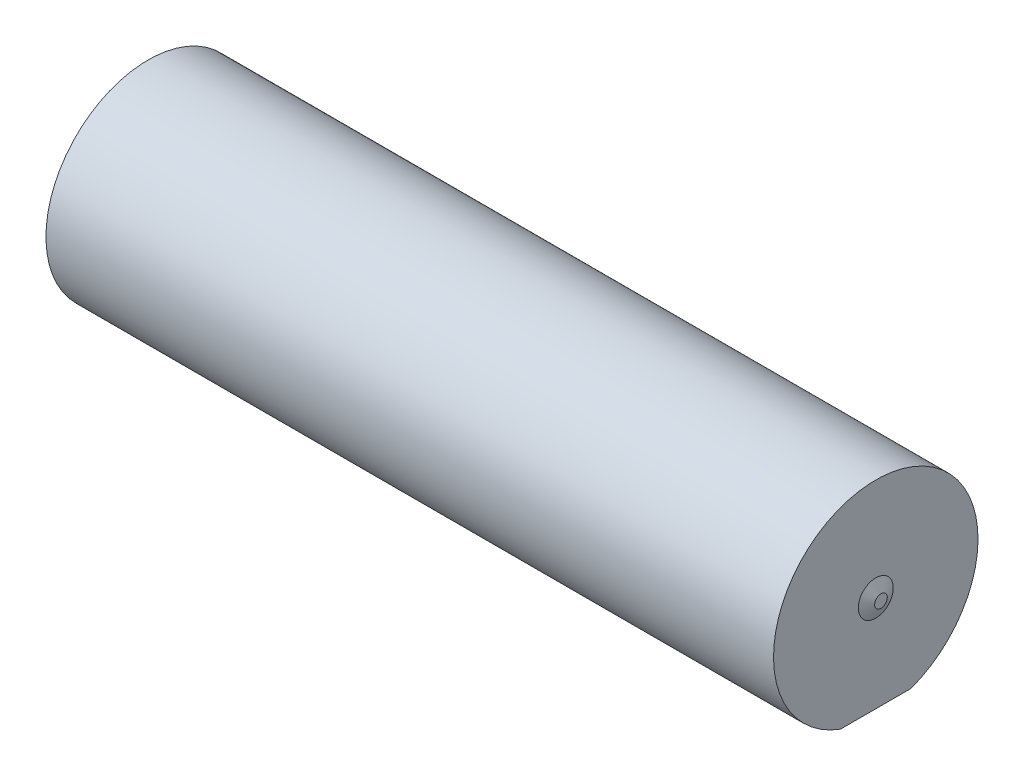
from build123d import *

# Parameters (mm, degrees)
IZIM3_R                     = 33.579638097
Y_KSEKLIK_EKSTR_ZYON1_DEPTH = 10
Y_KSEKLIK_EKSTR_ZYON1_TAPER = 65
KES_EKSTR_ZYON1_START       = 1000
KES_EKSTR_ZYON1_DEPTH       = 436
KES_EKSTR_ZYON2_DEPTH       = 729


with BuildPart() as part:
    # Çizim1 → Döndür2 (revolve)
    with BuildSketch(Plane.XY, mode=Mode.PRIVATE) as d_nd_r2_sk:
        with BuildLine():
            Line((0, 160), (800, 160))
            ThreePointArc((800, 160), (1108.966687108, 121.793262795), (1399.319473661, 9.474841102))
            Line((1399.319473661, 9.474841102), (1399.319473661, 196.645479286))
            Line((1399.319473661, 196.645479286), (0, 196.645479286))
            Line((0, 196.645479286), (0, 160))
        make_face()
    revolve(d_nd_r2_sk.sketch.rotate(Axis((0, 0, 0), (1, 0, 0)), 180), axis=Axis((0, 0, 0), (1, 0, 0)))

    # Çizim2 → Kes-Döndür1 (revolve, cut)
    with BuildSketch(Plane.XY, mode=Mode.PRIVATE) as kes_d_nd_r1_sk:
        with BuildLine():
            Line((1389.319473661, 26.059788693), (1389.319473661, 186.645479286))
            Line((1389.319473661, 186.645479286), (-316.134237936, 186.645479286))
            Line((-316.134237936, 186.645479286), (-316.134237936, 170))
            Line((-316.134237936, 170), (800, 170))
            ThreePointArc((800, 170), (1103.321704823, 133.493691238), (1389.319473661, 26.059788693))
        make_face()
    revolve(kes_d_nd_r1_sk.sketch.rotate(Axis((0, 0, 0), (1, 0, 0)), 180), axis=Axis((0, 0, 0), (1, 0, 0)), mode=Mode.SUBTRACT)

    # Çizim3 → Yükseklik-Ekstrüzyon1 (add)
    with BuildSketch(Plane(origin=(1399.319473661, 0, 0), x_dir=(0, 0, -1), z_dir=(1, 0, 0))):
        Circle(IZIM3_R)
    extrude(amount=Y_KSEKLIK_EKSTR_ZYON1_DEPTH, taper=Y_KSEKLIK_EKSTR_ZYON1_TAPER)

    # Çizim4 → Kes-Ekstrüzyon1 (cut)
    with BuildSketch(Plane(origin=(0, 0, 0), x_dir=(0, 0, -1), z_dir=(1, 0, 0)).offset(KES_EKSTR_ZYON1_START)):
        Polygon((97.176759239, -191.217657376), (-137.732913501, -191.217657376), (-99.977691978, -250.955991759), (64.615874303, -223.778542312), align=None)
    extrude(amount=KES_EKSTR_ZYON1_DEPTH, mode=Mode.SUBTRACT)

    # Çizim5 → Kes-Ekstrüzyon2 (cut)
    with BuildSketch(Plane(origin=(1000, 0, 0), x_dir=(0, 0, -1), z_dir=(1, 0, 0))):
        Polygon((-78.243246347, -184.594850552), (94.834250253, -184.594850552), (68.709345106, -210.7197557), (-83.685934919, -208.179834366), align=None)
    extrude(amount=KES_EKSTR_ZYON2_DEPTH, mode=Mode.SUBTRACT)


solid = part.part
